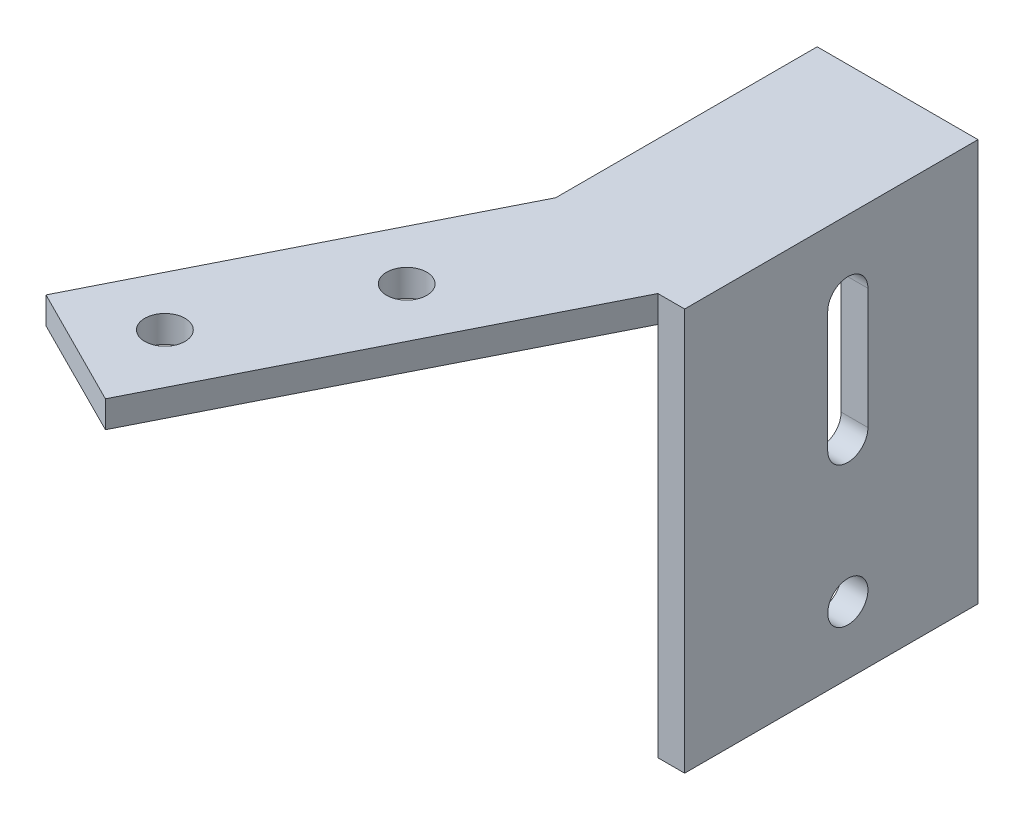
from build123d import *

# Parameters (mm, degrees)
SKETCH1_R           = 1.5
BOSS_EXTRUDE1_DEPTH = 2
SKETCH2_W           = 2
SKETCH2_H           = 21.888688708
BOSS_EXTRUDE2_DEPTH = 30
SKETCH4_R           = 1.5
CUT_EXTRUDE1_DEPTH  = 30


with BuildPart() as part:
    # Sketch1 → Boss-Extrude1 (new body)
    with BuildSketch(Plane(origin=(0, 0, 0), x_dir=(1, 0, 0), z_dir=(0, 1, 0))):
        Polygon((10.018564975, 30.6), (10.018564975, 8.711311292), (-3.787856503, -18.703932317), (-12.719216533, -14.206065265), (0.018564975, 11.087192922), (0.018564975, 30.6), align=None)
        with Locations(Location((0.018564975, -0.029187226, 0), (0, 0, 270))):
            Circle(SKETCH1_R, mode=Mode.SUBTRACT)
        with Locations(Location((-6.024680896, -12.029187226, 0), (0, 0, 270))):
            Circle(SKETCH1_R, mode=Mode.SUBTRACT)
    extrude(amount=BOSS_EXTRUDE1_DEPTH)

    # Sketch2 → Boss-Extrude2 (add)
    with BuildSketch(Plane(origin=(0, 2, 0), x_dir=(1, 0, 0), z_dir=(0, 1, 0))):
        with Locations((11.018564975, 19.655655646)):
            Rectangle(SKETCH2_W, SKETCH2_H)
    extrude(amount=-BOSS_EXTRUDE2_DEPTH)

    # Sketch4 → Cut-Extrude1 (cut)
    with BuildSketch(Plane(origin=(12.018564975, 0, 0), x_dir=(0, 0, -1), z_dir=(1, 0, 0))):
        with Locations((20.886224341, -23)):
            Circle(SKETCH4_R)
        with BuildLine():
            Line((22.386224341, -3.5), (22.386224341, -12.5))
            ThreePointArc((22.386224341, -12.5), (20.886224341, -14), (19.386224341, -12.5))
            Line((19.386224341, -12.5), (19.386224341, -3.5))
            ThreePointArc((19.386224341, -3.5), (20.886224341, -2), (22.386224341, -3.5))
        make_face()
    extrude(amount=-CUT_EXTRUDE1_DEPTH, mode=Mode.SUBTRACT)


solid = part.part
